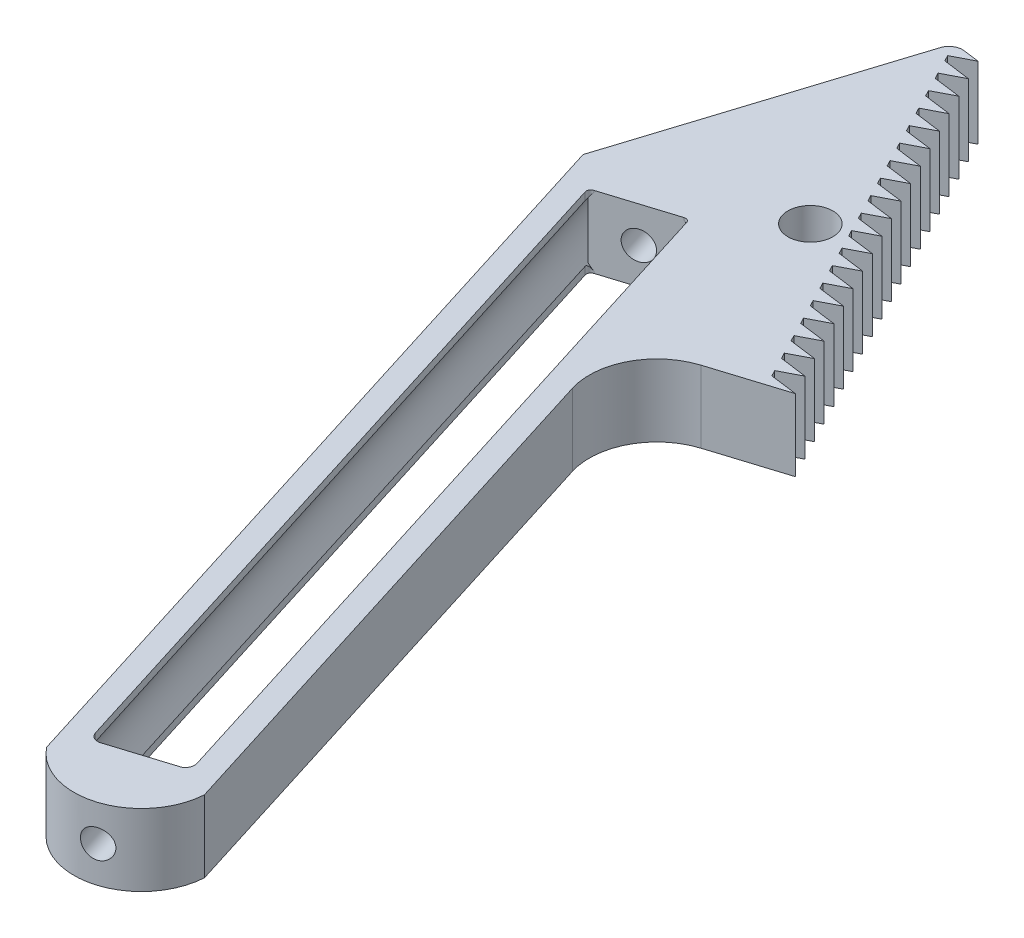
from build123d import *

# Parameters (mm, degrees)
SKETCH1_R                = 4
BOSS_EXTRUDE1_DEPTH      = 16
CUT_EXTRUDE2_DEPTH       = 243.712011885
FILLET2_R                = 50
FILLET3_R                = 5
BOSS_EXTRUDE2_DEPTH      = 16
LPATTERN1_COUNT          = 58
LPATTERN1_PITCH          = 5
SKETCH6_R                = 5.25
CUT_EXTRUDE4_DEPTH       = 3.2
BOSS_EXTRUDE3_START      = -11.8
SKETCH8_R                = 4
SKETCH8_R_2              = 2
BOSS_EXTRUDE3_DEPTH      = 11.8
SKETCH9_R                = 5
CUT_EXTRUDE7_DEPTH       = 9.8
BOSS_EXTRUDE4_DEPTH      = 16
CUT_EXTRUDE8_DEPTH       = 330.19878797
CUT_EXTRUDE8_DEPTH_BACK  = 330.19878797
SKETCH10_R               = 3.15
CUT_EXTRUDE9_DEPTH       = 230.693221824
CUT_EXTRUDE10_DEPTH      = 230.693221824
CUT_EXTRUDE13_DEPTH      = 228.62792195
FILLET6_R                = 15
FILLET7_R                = 2
SKETCH18_R               = 11
CUT_EXTRUDE14_DEPTH      = 180
CUT_EXTRUDE15_DEPTH      = 211.145198264
CUT_EXTRUDE15_DEPTH_BACK = 211.145198264
BOSS_EXTRUDE5_REACH      = 203.817
FILLET8_R                = 1
FILLET9_R                = 3
CUT_EXTRUDE16_DEPTH      = 239.866298177
CUT_EXTRUDE16_DEPTH_BACK = 239.866298177
SKETCH21_R               = 3.15


with BuildPart() as part:
    # Sketch1 → Boss-Extrude1 (new body)
    with BuildSketch(Plane(origin=(0, 0, 0), x_dir=(1, 0, 0), z_dir=(0, 1, 0))):
        Polygon((0, 0), (-70, 135), (-70, -15), (-70, -215), (111.481481481, -215), align=None)
        with Locations(Location((-5, -5, 0), (0, 0, 270))):
            Circle(SKETCH1_R, mode=Mode.SUBTRACT)
    extrude(amount=BOSS_EXTRUDE1_DEPTH)

    # Sketch3 → Cut-Extrude2 (cut, through all)
    with BuildSketch(Plane(origin=(0, 16, 0), x_dir=(1, 0, 0), z_dir=(0, 1, 0))):
        Polygon((-52.442610269, 88.104828667), (-69.618224346, 82.719823463), (14.148523277, -184.456395525), (31.324137355, -179.07139032), align=None)
    extrude(amount=-CUT_EXTRUDE2_DEPTH, mode=Mode.SUBTRACT)

    # Fillet2
    fillet2_edges = [part.edges().sort_by_distance(p)[0] for p in [
        (111.481481481, 8, 215),
        (-70, 8, 215),
    ]]
    fillet(fillet2_edges, radius=FILLET2_R)

    # Fillet3
    fillet3_edges = [part.edges().sort_by_distance(p)[0] for p in [
        (-70, 8, -135),
    ]]
    fillet(fillet3_edges, radius=FILLET3_R)

    # Sketch4 → Boss-Extrude2 (add)
    with BuildSketch(Plane(origin=(0, 16, 0), x_dir=(1, 0, 0), z_dir=(0, 1, 0))):
        Polygon((-60.561227343, 116.796652732), (-54.510866943, 115.99017648), (-58.9496396, 113.688590657), align=None)
    boss_extrude2 = extrude(amount=-BOSS_EXTRUDE2_DEPTH)

    # LPattern1: Boss-Extrude2 ×58
    with Locations(*[Vector(0.46031716445500054, 0, 0.8877545314489294) * (i * LPATTERN1_PITCH) for i in range(1, LPATTERN1_COUNT)]):
        add(boss_extrude2)

    # Sketch6 → Cut-Extrude4 (cut)
    with BuildSketch(Plane.XZ):
        with Locations(Location((-5, 5, 0), (0, 0, 270))):
            Circle(SKETCH6_R)
    extrude(amount=-CUT_EXTRUDE4_DEPTH, mode=Mode.SUBTRACT)

    # Sketch8 → Boss-Extrude3 (add)
    with BuildSketch(Plane(origin=(0, 16, 0), x_dir=(1, 0, 0), z_dir=(0, 1, 0)).offset(BOSS_EXTRUDE3_START)):
        with Locations(Location((-5, -5, 0), (0, 0, 90))):
            Circle(SKETCH8_R)
        with Locations(Location((-5, -5, 0), (0, 0, 270))):
            Circle(SKETCH8_R_2, mode=Mode.SUBTRACT)
    extrude(amount=BOSS_EXTRUDE3_DEPTH)

    # Sketch9 → Cut-Extrude7 (cut)
    with BuildSketch(Plane(origin=(0, 16, 0), x_dir=(1, 0, 0), z_dir=(0, 1, 0))):
        with Locations(Location((-5, -5, 0), (0, 0, 270))):
            Circle(SKETCH9_R)
    extrude(amount=-CUT_EXTRUDE7_DEPTH, mode=Mode.SUBTRACT)

    # Sketch12 → Boss-Extrude4 (add)
    with BuildSketch(Plane(origin=(0, 16, 0), x_dir=(1, 0, 0), z_dir=(0, 1, 0))):
        with BuildLine():
            Line((-70, 114.49506691), (-70, 54.49506691))
            ThreePointArc((-70, 54.49506691), (-73.030615433, 84.49506691), (-70, 114.49506691))
        make_face()
    extrude(amount=-BOSS_EXTRUDE4_DEPTH)

    # Sketch10 → Cut-Extrude8 (cut, two sides: drawn at the far end of the back side and taken through both)
    with BuildSketch(Plane(origin=(-29.844534263, 0, -95.189917814), x_dir=(0.954200782099043, 0, -0.29916695579822083), z_dir=(0.29916695579822083, 0, 0.954200782099043)).offset(-CUT_EXTRUDE8_DEPTH_BACK)):
        with Locations(Location((-32.68272635, 8, 0), (0, 0, 272.580314011))):
            Circle(SKETCH10_R)
    extrude(amount=CUT_EXTRUDE8_DEPTH + CUT_EXTRUDE8_DEPTH_BACK, mode=Mode.SUBTRACT)

    # Sketch13 → Cut-Extrude9 (cut, through all)
    with BuildSketch(Plane(origin=(0, 16, 0), x_dir=(1, 0, 0), z_dir=(0, 1, 0))):
        Polygon((-74.389228257, 81.223988684), (30.319206273, -252.746285051), (-65.100871937, -282.662980631), (-169.809306467, 51.307293104), align=None)
    extrude(amount=-CUT_EXTRUDE9_DEPTH, mode=Mode.SUBTRACT)

    # Sketch15 → Cut-Extrude10 (cut, through all)
    with BuildSketch(Plane(origin=(0, 16, 0), x_dir=(1, 0, 0), z_dir=(0, 1, 0))):
        Polygon((91.161899767, -18.950897803), (-4.258178443, -48.867593383), (70.533560507, -287.417788908), (165.953638717, -257.501093328), align=None)
    extrude(amount=-CUT_EXTRUDE10_DEPTH, mode=Mode.SUBTRACT)

    # Sketch16 → Cut-Extrude13 (cut, through all)
    with BuildSketch(Plane(origin=(0, 16, 0), x_dir=(1, 0, 0), z_dir=(0, 1, 0))):
        with BuildLine():
            Line((10.873354146, -190.723234214), (40.790049725, -286.143312424))
            Line((40.790049725, -286.143312424), (67.507671624, -277.766637662))
            Line((67.507671624, -277.766637662), (37.590976044, -182.346559452))
            ThreePointArc((37.590976044, -182.346559452), (27.10860607, -195.709380094), (10.873354146, -190.723234214))
        make_face()
    extrude(amount=-CUT_EXTRUDE13_DEPTH, mode=Mode.SUBTRACT)

    # Fillet6
    fillet6_edges = [part.edges().sort_by_distance(p)[0] for p in [
        (-4.258178443, 8, 48.867593383),
    ]]
    fillet(fillet6_edges, radius=FILLET6_R)

    # Fillet7
    fillet7_edges = [part.edges().sort_by_distance(p)[0] for p in [
        (-52.442610269, 8, -88.104828667),
        (31.324137355, 8, 179.07139032),
        (14.148523277, 8, 184.456395525),
        (-69.618224346, 8, -82.719823463),
    ]]
    fillet(fillet7_edges, radius=FILLET7_R)

    # Sketch18 → Cut-Extrude14 (cut)
    with BuildSketch(Plane(origin=(53.92221336, 0, 171.986301173), x_dir=(-0.9542007820990451, 0, 0.2991669557982141), z_dir=(-0.2991669557982141, 0, -0.9542007820990451))):
        with Locations((32.68272635, 8)):
            Circle(SKETCH18_R)
    extrude(amount=CUT_EXTRUDE14_DEPTH, mode=Mode.SUBTRACT)

    # Sketch19 → Cut-Extrude15 (cut, two sides: drawn at the far end of the back side and taken through both)
    with BuildSketch(Plane(origin=(0, 16, 0), x_dir=(1, 0, 0), z_dir=(0, 1, 0)).offset(-CUT_EXTRUDE15_DEPTH_BACK)):
        Polygon((-23.735854186, 45.776290217), (-43.616849953, -16.925311817), (-182.188010341, 92.887453174), (-34.776254673, 144.843881828), (-3.278660629, 45.963592539), align=None)
    extrude(amount=CUT_EXTRUDE15_DEPTH + CUT_EXTRUDE15_DEPTH_BACK, mode=Mode.SUBTRACT)

    # Boss-Extrude5: up to this face of the body (flat: up to its plane)
    boss_extrude5_end = Plane(part.part.faces().sort_by_distance((-3.292295487, 0, 60.867970257))[0])
    # Sketch20 → Boss-Extrude5 (add, up to the picked face)
    with BuildSketch(Plane(origin=(0, 16, 0), x_dir=(1, 0, 0), z_dir=(0, 1, 0)), mode=Mode.PRIVATE) as boss_extrude5_sk1:
        Polygon((-31.497089872, 21.298546901), (-40.982119501, -8.615777313), (-36.494615164, -22.928789044), (-19.319001086, -17.54378384), align=None)
    boss_extrude5_tool1 = split(extrude(boss_extrude5_sk1.sketch, amount=-BOSS_EXTRUDE5_REACH, mode=Mode.PRIVATE), bisect_by=boss_extrude5_end, keep=Keep.BOTH, mode=Mode.PRIVATE)
    add(boss_extrude5_tool1.solids().sort_by(Axis((-31.047961, 16, 5.590001), (0, -1, 0)))[0])

    # Fillet8
    fillet8_edges = [part.edges().sort_by_distance(p)[0] for p in [
        (-36.494615164, 15.16227766, 22.928789044),
        (-36.494615164, 0.83772234, 22.928789044),
        (-19.319001086, 0.83772234, 17.54378384),
        (-19.319001086, 15.16227766, 17.54378384),
    ]]
    fillet(fillet8_edges, radius=FILLET8_R)

    # Fillet9
    fillet9_edges = [part.edges().sort_by_distance(p)[0] for p in [
        (-23.735854186, 8, -45.776290217),
    ]]
    fillet(fillet9_edges, radius=FILLET9_R)

    # Sketch21 → Cut-Extrude16 (cut, two sides: drawn at the far end of the back side and taken through both)
    with BuildSketch(Plane(origin=(53.92221336, 0, 171.986301173), x_dir=(-0.9542007820990451, 0, 0.2991669557982141), z_dir=(-0.2991669557982141, 0, -0.9542007820990451)).offset(-CUT_EXTRUDE16_DEPTH_BACK)):
        with Locations(Location((32.68272635, 8, 0), (0, 0, 180))):
            Circle(SKETCH21_R)
    extrude(amount=CUT_EXTRUDE16_DEPTH + CUT_EXTRUDE16_DEPTH_BACK, mode=Mode.SUBTRACT)


solid = part.part
